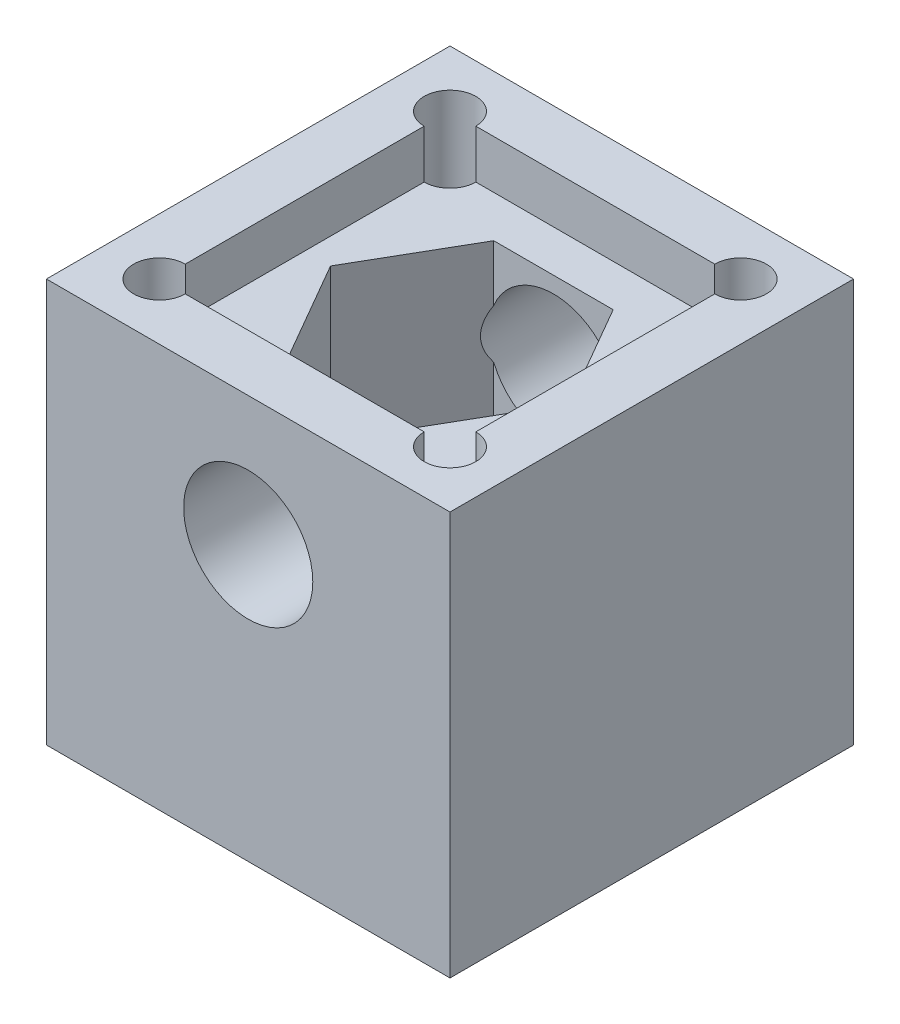
from build123d import *

# Parameters (mm, degrees)
SKETCH1_W           = 25
SKETCH1_H           = 25
BOSS_EXTRUDE1_DEPTH = 25
SKETCH2_R           = 4
CUT_EXTRUDE1_DEPTH  = 38.5
SKETCH4_R           = 4.15
CUT_EXTRUDE2_DEPTH  = 31.618621785
CUT_EXTRUDE3_DEPTH  = 18
SKETCH6_R           = 1.6
CUT_EXTRUDE4_DEPTH  = 31.618621785
SKETCH7_W           = 18
SKETCH7_H           = 18
CUT_EXTRUDE5_DEPTH  = 3


with BuildPart() as part:
    # Sketch1 → Boss-Extrude1 (new body)
    with BuildSketch(Plane(origin=(0, 0, 0), x_dir=(1, 0, 0), z_dir=(0, 1, 0))):
        Rectangle(SKETCH1_W, SKETCH1_H)
    extrude(amount=BOSS_EXTRUDE1_DEPTH)

    # Sketch2 → Cut-Extrude1 (cut, through all)
    with BuildSketch(Plane.XY.offset(12.5)):
        with Locations((0, 17)):
            Circle(SKETCH2_R)
    extrude(amount=-CUT_EXTRUDE1_DEPTH, mode=Mode.SUBTRACT)

    # Sketch4 → Cut-Extrude2 (cut, through all)
    with BuildSketch(Plane(origin=(0, 25, 0), x_dir=(1, 0, 0), z_dir=(0, 1, 0))):
        with Locations(Location((0, 0, 0), (0, 0, 270))):
            Circle(SKETCH4_R)
    extrude(amount=-CUT_EXTRUDE2_DEPTH, mode=Mode.SUBTRACT)

    # Sketch5 → Cut-Extrude3 (cut)
    with BuildSketch(Plane(origin=(0, 25, 0), x_dir=(1, 0, 0), z_dir=(0, 1, 0))):
        Polygon((-3.7, -6.408587988), (3.7, -6.408587988), (7.4, 0), (3.7, 6.408587988), (-3.7, 6.408587988), (-7.4, 0), align=None)
    extrude(amount=-CUT_EXTRUDE3_DEPTH, mode=Mode.SUBTRACT)

    # Sketch6 → Cut-Extrude4 (cut, through all)
    with BuildSketch(Plane(origin=(0, 25, 0), x_dir=(1, 0, 0), z_dir=(0, 1, 0))):
        with Locations(Location((9, -9, 0), (0, 0, 270))):
            Circle(SKETCH6_R)
        with Locations(Location((-9, -9, 0), (0, 0, 270))):
            Circle(SKETCH6_R)
        with Locations(Location((-9, 9, 0), (0, 0, 270))):
            Circle(SKETCH6_R)
        with Locations(Location((9, 9, 0), (0, 0, 270))):
            Circle(SKETCH6_R)
    extrude(amount=-CUT_EXTRUDE4_DEPTH, mode=Mode.SUBTRACT)

    # Sketch7 → Cut-Extrude5 (cut)
    with BuildSketch(Plane(origin=(0, 25, 0), x_dir=(1, 0, 0), z_dir=(0, 1, 0))):
        Rectangle(SKETCH7_W, SKETCH7_H)
    extrude(amount=-CUT_EXTRUDE5_DEPTH, mode=Mode.SUBTRACT)


solid = part.part
